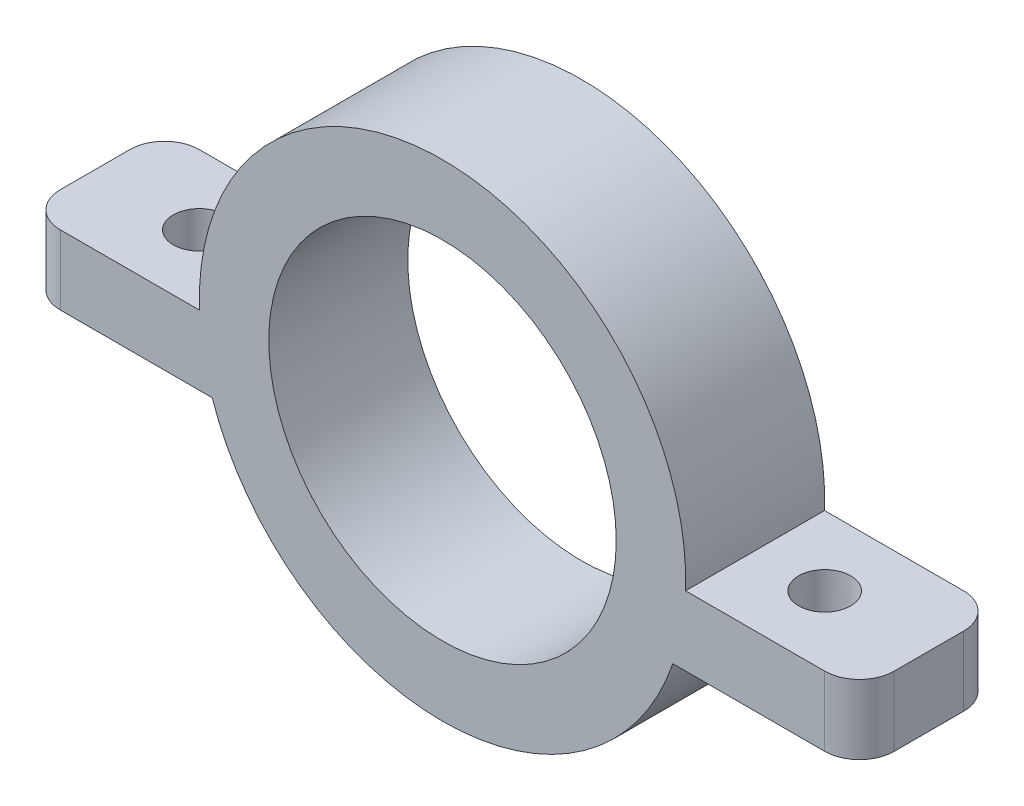
from build123d import *

# Parameters (mm, degrees)
SALIENTE_EXTRUIR1_DEPTH = 8
CROQUIS2_R              = 10
CORTAR_EXTRUIR1_DEPTH   = 29.91366459
REDONDEO1_R             = 2
CROQUIS3_R              = 1.5
CORTAR_EXTRUIR2_DEPTH   = 30.159046624


with BuildPart() as part:
    # Croquis1 → Saliente-Extruir1 (new body)
    with BuildSketch(Plane.XY):
        with BuildLine():
            Line((-24, -0.5), (-13.99106858, -0.5))
            ThreePointArc((-13.99106858, -0.5), (0, 14), (13.99106858, -0.5))
            Line((13.99106858, -0.5), (24, -0.5))
            Line((24, -0.5), (24, -4.5))
            Line((24, -4.5), (13.257073584, -4.5))
            ThreePointArc((13.257073584, -4.5), (0, -14), (-13.257073584, -4.5))
            Line((-13.257073584, -4.5), (-24, -4.5))
            Line((-24, -4.5), (-24, -0.5))
        make_face()
    extrude(amount=SALIENTE_EXTRUIR1_DEPTH)

    # Croquis2 → Cortar-Extruir1 (cut, through all)
    with BuildSketch(Plane.XY.offset(8)):
        Circle(CROQUIS2_R)
    extrude(amount=-CORTAR_EXTRUIR1_DEPTH, mode=Mode.SUBTRACT)

    # Redondeo1
    redondeo1_edges = [part.edges().sort_by_distance(p)[0] for p in [
        (24, -2.5, 8),
        (-24, -2.5, 8),
        (-24, -2.5, 0),
        (24, -2.5, 0),
    ]]
    fillet(redondeo1_edges, radius=REDONDEO1_R)

    # Croquis3 → Cortar-Extruir2 (cut, through all)
    with BuildSketch(Plane(origin=(0, -0.5, 0), x_dir=(1, 0, 0), z_dir=(0, 1, 0))):
        with Locations(Location((-17.99553429, -4, 0), (0, 0, 270))):
            Circle(CROQUIS3_R)
        with Locations(Location((17.99553429, -4, 0), (0, 0, 270))):
            Circle(CROQUIS3_R)
    extrude(amount=-CORTAR_EXTRUIR2_DEPTH, mode=Mode.SUBTRACT)


solid = part.part
